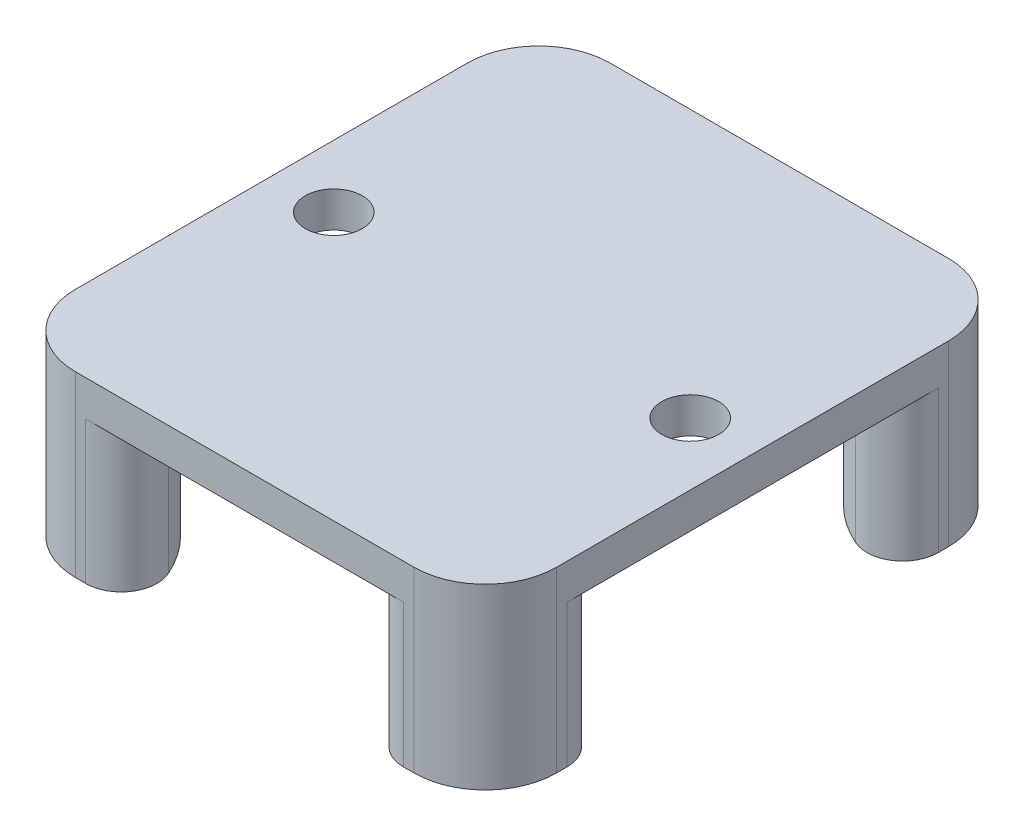
from build123d import *

# Parameters (mm, degrees)
SZKIC1_W                    = 27
SZKIC1_H                    = 30
SZKIC1_R                    = 1.6
DODANIE_WYCI_GNI_CIE1_DEPTH = 2
DODANIE_WYCI_GNI_CIE2_DEPTH = 8
ZAOKR_GLENIE1_R             = 4
ZAOKR_GLENIE2_R             = 2


with BuildPart() as part:
    # Szkic1 → Dodanie-wyciągnięcie1 (new body)
    with BuildSketch(Plane(origin=(0, 0, 0), x_dir=(1, 0, 0), z_dir=(0, 1, 0))):
        Rectangle(SZKIC1_W, SZKIC1_H)
        with Locations(Location((10, 0, 0), (0, 0, 270))):
            Circle(SZKIC1_R, mode=Mode.SUBTRACT)
        with Locations(Location((-10, 0, 0), (0, 0, 270))):
            Circle(SZKIC1_R, mode=Mode.SUBTRACT)
    extrude(amount=DODANIE_WYCI_GNI_CIE1_DEPTH)

    # Szkic2 → Dodanie-wyciągnięcie2 (add)
    with BuildSketch(Plane.XZ):
        with BuildLine():
            Line((-13.5, 8), (-13.5, 15))
            Line((-13.5, 15), (-6.5, 15))
            ThreePointArc((-6.5, 15), (-8.550252532, 10.050252532), (-13.5, 8))
        make_face()
        with BuildLine():
            Line((13.5, 8), (13.5, 15))
            Line((13.5, 15), (6.5, 15))
            ThreePointArc((6.5, 15), (8.550252532, 10.050252532), (13.5, 8))
        make_face()
        with BuildLine():
            Line((13.5, -15), (6.5, -15))
            ThreePointArc((6.5, -15), (8.550252532, -10.050252532), (13.5, -8))
            Line((13.5, -8), (13.5, -15))
        make_face()
        with BuildLine():
            Line((-13.5, -8), (-13.5, -15))
            Line((-13.5, -15), (-6.5, -15))
            ThreePointArc((-6.5, -15), (-8.550252532, -10.050252532), (-13.5, -8))
        make_face()
    extrude(amount=DODANIE_WYCI_GNI_CIE2_DEPTH)

    # Zaokrąglenie1
    zaokr_glenie1_edges = [part.edges().sort_by_distance(p)[0] for p in [
        (13.5, -3, 15),
        (-13.5, -3, 15),
        (-13.5, -3, -15),
        (13.5, -3, -15),
    ]]
    fillet(zaokr_glenie1_edges, radius=ZAOKR_GLENIE1_R)

    # Zaokrąglenie2
    zaokr_glenie2_edges = [part.edges().sort_by_distance(p)[0] for p in [
        (-6.5, -4, 15),
        (-13.5, -4, 8),
        (6.5, -4, 15),
        (13.5, -4, 8),
        (13.5, -4, -8),
        (6.5, -4, -15),
        (-6.5, -4, -15),
        (-13.5, -4, -8),
    ]]
    fillet(zaokr_glenie2_edges, radius=ZAOKR_GLENIE2_R)


solid = part.part
